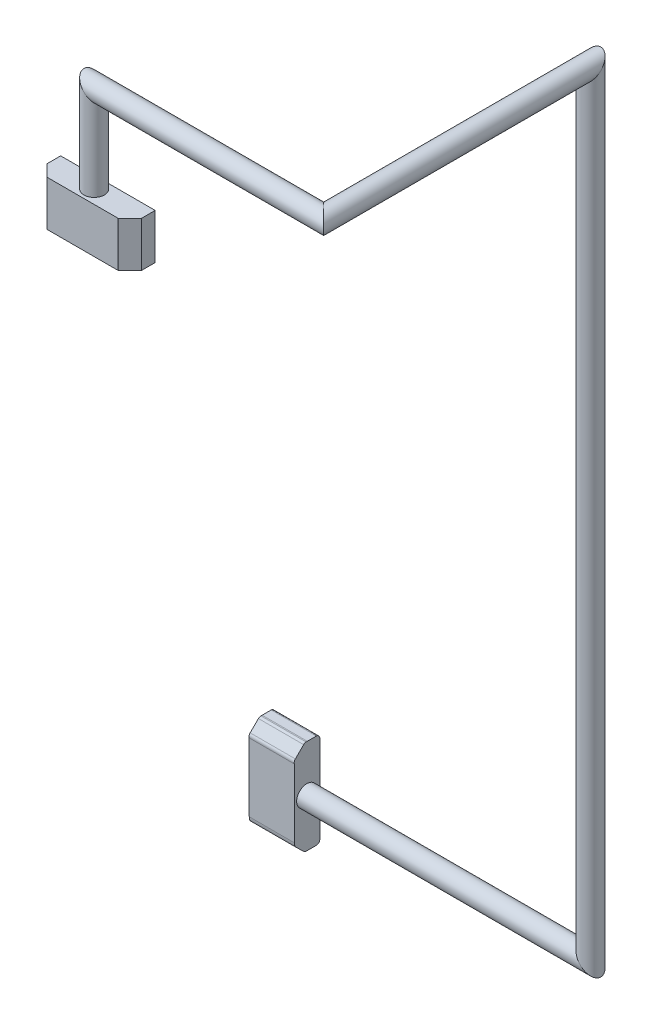
from build123d import *

# Parameters (mm, degrees)
ESQUISSE1_R        = 0.75
BOSS_EXTRU_1_DEPTH = 3.3
BOSS_EXTRU_2_DEPTH = 3.3


with BuildPart() as part:
    # Balayage1: sweep along a curve in space
    with BuildLine() as balayage1_path:
        Line((0, 0, 0), (20.71, 0, 0))
        Line((20.71, 0, 0), (20.71, 56.56, 0))
        Line((20.71, 56.56, 0), (20.71, 56.56, 19.48))
        Line((20.71, 56.56, 19.48), (3.95, 56.56, 19.48))
        Line((3.95, 56.56, 19.48), (3.95, 50.06, 19.48))
    # Esquisse1 → Balayage1 (sweep)
    with BuildSketch(Plane(origin=(0, 0, 0), x_dir=(0, 0, -1), z_dir=(1, 0, 0))):
        Circle(ESQUISSE1_R)
    sweep(path=balayage1_path.line, transition=Transition.RIGHT)

    # Esquisse2 → Boss.-Extru.1 (add)
    with BuildSketch(Plane.ZY):
        with BuildLine():
            Line((-0.693559654, 3.410973121), (-0.033559654, 3.410973121))
            Line((-0.033559654, 3.410973121), (0.052886955, 3.410800656))
            ThreePointArc((0.052886955, 3.410800656), (0.152585895, 3.390814178), (0.237103646, 3.334280227))
            Line((0.237103646, 3.334280227), (0.840288261, 2.731095613))
            ThreePointArc((0.840288261, 2.731095613), (0.915698502, 2.601090787), (0.916612811, 2.450800656))
            Line((0.916612811, 2.450800656), (0.907780092, -2.544199344))
            ThreePointArc((0.907780092, -2.544199344), (0.890549579, -2.690753591), (0.840288109, -2.829493716))
            Line((0.840288109, -2.829493716), (0.229663651, -3.425976039))
            ThreePointArc((0.229663651, -3.425976039), (0.148335129, -3.479631619), (0.052886955, -3.499199344))
            Line((0.052886955, -3.499199344), (-0.683559654, -3.499199344))
            ThreePointArc((-0.683559654, -3.499199344), (-0.867407417, -3.423047107), (-0.943559654, -3.239199344))
            Line((-0.943559654, -3.239199344), (-0.943559654, 3.142794831))
            ThreePointArc((-0.943559654, 3.142794831), (-0.871366367, 3.326111221), (-0.693559654, 3.410973121))
        make_face()
    extrude(amount=BOSS_EXTRU_1_DEPTH)

    # Esquisse8 → Boss.-Extru.2 (add)
    with BuildSketch(Plane.XZ.offset(-50.06)):
        with BuildLine():
            Line((0.626082703, 19.600404574), (0.626082703, 18.6131001))
            ThreePointArc((0.626082703, 18.6131001), (0.629011635, 18.606029032), (0.636082703, 18.6031001))
            Line((0.636082703, 18.6031001), (7.516082703, 18.6031001))
            ThreePointArc((7.516082703, 18.6031001), (7.523153771, 18.606029032), (7.526082703, 18.6131001))
            Line((7.526082703, 18.6131001), (7.526082703, 19.600404544))
            ThreePointArc((7.526082703, 19.600404544), (7.524677417, 19.603797205), (7.521284755, 19.605202492))
            Line((7.521284755, 19.605202492), (6.680559004, 20.450070379))
            ThreePointArc((6.680559004, 20.450070379), (6.677327923, 20.452237942), (6.673512365, 20.452999341))
            Line((6.673512365, 20.452999341), (1.47867747, 20.452999341))
            Line((1.47867747, 20.452999341), (0.633809583, 19.612273589))
            ThreePointArc((0.633809583, 19.612273589), (0.629318413, 19.606747742), (0.626082703, 19.600404574))
        make_face()
    extrude(amount=BOSS_EXTRU_2_DEPTH)


solid = part.part
